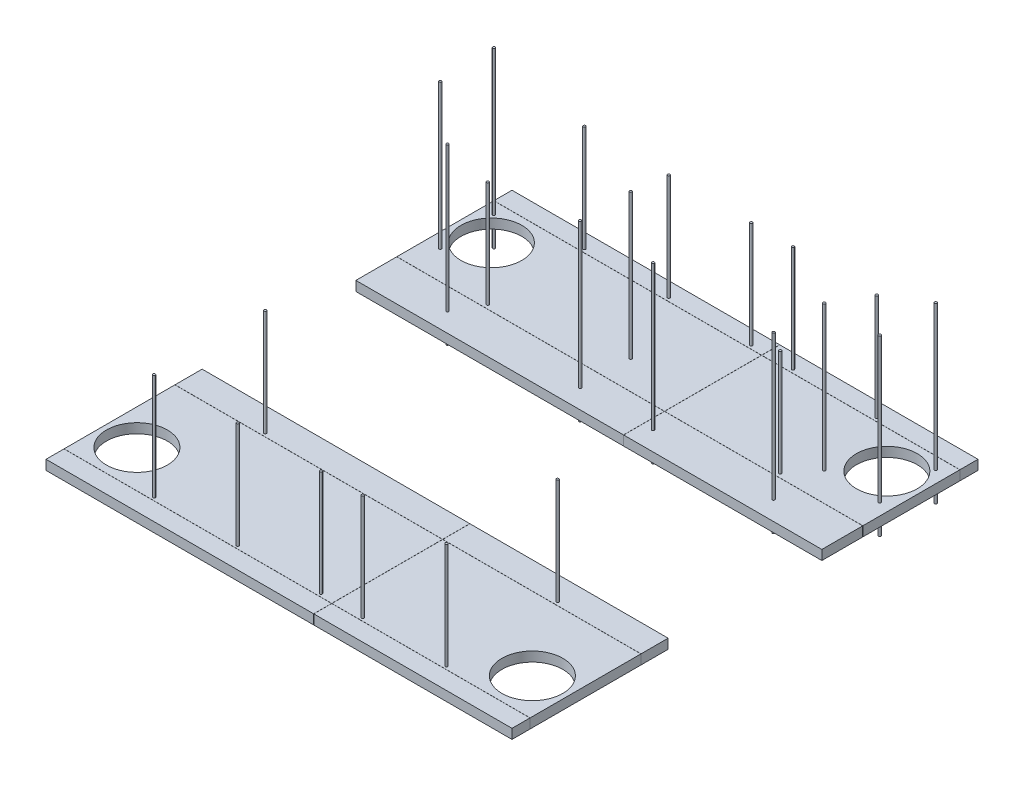
from build123d import *

# Parameters (mm, degrees)
SKETCH1_W                        = 4908.55
SKETCH1_H                        = 4908.55
BOSS_EXTRUDE1_DEPTH              = 101.6
SKETCH2_W                        = 4908.55
SKETCH2_H                        = 1619.25
CUT_EXTRUDE1_DEPTH               = 3473.355700566
SKETCH4_W                        = 4908.55
SKETCH4_H                        = 1.27
CUT_EXTRUDE_THIN1_DEPTH          = 3473.355700566
CUT_EXTRUDE_THIN2_DEPTH          = 3473.355700566
CUT_EXTRUDE_THIN2_DEPTH_BACK     = 3473.355700566
SKETCH5_W                        = 1.27
SKETCH5_H                        = 4908.55
SKETCH6_R                        = 320.675
CUT_EXTRUDE2_DEPTH               = 3473.355700566
STUD_LAYOUT_SKETCH_DEPTH         = 1524
STUD_LAYOUT_SKETCH_DEPTH_BACK    = 304.8
SKETCH7_R                        = 12.7
STUD_LAYOUT_SKETCH_2_DEPTH       = 1524
STUD_LAYOUT_SKETCH_2_DEPTH_BACK  = 304.8
STUD_LAYOUT_SKETCH_3_DEPTH       = 1524
STUD_LAYOUT_SKETCH_3_DEPTH_BACK  = 304.8
STUD_LAYOUT_SKETCH_4_DEPTH       = 1524
STUD_LAYOUT_SKETCH_4_DEPTH_BACK  = 304.8
STUD_LAYOUT_SKETCH_5_DEPTH       = 1524
STUD_LAYOUT_SKETCH_5_DEPTH_BACK  = 304.8
STUD_LAYOUT_SKETCH_6_DEPTH       = 1524
STUD_LAYOUT_SKETCH_6_DEPTH_BACK  = 304.8
STUD_LAYOUT_SKETCH_7_DEPTH       = 1524
STUD_LAYOUT_SKETCH_7_DEPTH_BACK  = 304.8
STUD_LAYOUT_SKETCH_8_DEPTH       = 1524
STUD_LAYOUT_SKETCH_8_DEPTH_BACK  = 304.8
STUD_LAYOUT_SKETCH_9_DEPTH       = 1524
STUD_LAYOUT_SKETCH_9_DEPTH_BACK  = 304.8
STUD_LAYOUT_SKETCH_10_DEPTH      = 1524
STUD_LAYOUT_SKETCH_10_DEPTH_BACK = 304.8
STUD_LAYOUT_SKETCH_11_DEPTH      = 1524
STUD_LAYOUT_SKETCH_11_DEPTH_BACK = 304.8
STUD_LAYOUT_SKETCH_12_DEPTH      = 1524
STUD_LAYOUT_SKETCH_12_DEPTH_BACK = 304.8
STUD_LAYOUT_SKETCH_13_DEPTH      = 1524
STUD_LAYOUT_SKETCH_13_DEPTH_BACK = 304.8
STUD_LAYOUT_SKETCH_14_DEPTH      = 1524
STUD_LAYOUT_SKETCH_14_DEPTH_BACK = 304.8
STUD_LAYOUT_SKETCH_15_DEPTH      = 1524
STUD_LAYOUT_SKETCH_15_DEPTH_BACK = 304.8
STUD_LAYOUT_SKETCH_16_DEPTH      = 1524
STUD_LAYOUT_SKETCH_16_DEPTH_BACK = 304.8
STUD_LAYOUT_SKETCH_17_DEPTH      = 1524
STUD_LAYOUT_SKETCH_17_DEPTH_BACK = 304.8
STUD_LAYOUT_SKETCH_18_DEPTH      = 1524
STUD_LAYOUT_SKETCH_18_DEPTH_BACK = 304.8
STUD_LAYOUT_SKETCH_19_DEPTH      = 1524
STUD_LAYOUT_SKETCH_19_DEPTH_BACK = 304.8
STUD_LAYOUT_SKETCH_20_DEPTH      = 1524
STUD_LAYOUT_SKETCH_20_DEPTH_BACK = 304.8
STUD_LAYOUT_SKETCH_21_DEPTH      = 1524
STUD_LAYOUT_SKETCH_21_DEPTH_BACK = 304.8
STUD_LAYOUT_SKETCH_22_DEPTH      = 1524
STUD_LAYOUT_SKETCH_22_DEPTH_BACK = 304.8
STUD_LAYOUT_SKETCH_23_DEPTH      = 1524
STUD_LAYOUT_SKETCH_23_DEPTH_BACK = 304.8
STUD_LAYOUT_SKETCH_24_DEPTH      = 1524
STUD_LAYOUT_SKETCH_24_DEPTH_BACK = 304.8
SKETCH8_W                        = 5497.787174958
SKETCH8_H                        = 7518.420007062
CUT_EXTRUDE5_DEPTH               = 406.4
SKETCH9_W                        = 5184.868781488
SKETCH9_H                        = 7370.4919608
CUT_EXTRUDE6_DEPTH               = 254


with BuildPart() as part:
    # Sketch1 → Boss-Extrude1 (new body)
    with BuildSketch(Plane(origin=(0, 0, 0), x_dir=(1, 0, 0), z_dir=(0, 1, 0))):
        Rectangle(SKETCH1_W, SKETCH1_H)
    extrude(amount=BOSS_EXTRUDE1_DEPTH)

    # Sketch2 → Cut-Extrude1 (cut, through all)
    with BuildSketch(Plane(origin=(0, 101.6, 0), x_dir=(1, 0, 0), z_dir=(0, 1, 0))):
        Rectangle(SKETCH2_W, SKETCH2_H)
    extrude(amount=-CUT_EXTRUDE1_DEPTH, mode=Mode.SUBTRACT)


with BuildPart() as cut_extrude1_piece_1:
    # of the separate pieces the step leaves, piece 1, a body of its own (cut_extrude1_pieces)
    add(part.part.solids().sort_by_distance((-2454.275, 0, -2454.275))[0])


with BuildPart() as cut_extrude1_piece_2:
    # of the separate pieces the step leaves, piece 2, a body of its own (cut_extrude1_pieces)
    add(part.part.solids().sort_by_distance((-2454.275, 0, 2454.275))[0])


with BuildPart() as cut_extrude_thin1_tool:
    # Sketch4 → Cut-Extrude-Thin1 (new, through all)
    with BuildSketch(Plane(origin=(0, 101.6, 0), x_dir=(1, 0, 0), z_dir=(0, 1, 0))):
        with Locations((0, -2264.41)):
            Rectangle(SKETCH4_W, SKETCH4_H)
        with Locations((0, -1096.01)):
            Rectangle(SKETCH4_W, SKETCH4_H)
        with Locations((0, 2263.14)):
            Rectangle(SKETCH4_W, SKETCH4_H)
        with Locations((0, 1240.79)):
            Rectangle(SKETCH4_W, SKETCH4_H)
    extrude(amount=-CUT_EXTRUDE_THIN1_DEPTH)


with BuildPart() as cut_extrude1_piece_1_1:
    add(cut_extrude1_piece_1.part)

    # Cut-Extrude-Thin1: cut by cut_extrude_thin1_tool
    add(cut_extrude_thin1_tool.part, mode=Mode.SUBTRACT)


with BuildPart() as cut_extrude1_piece_2_1:
    add(cut_extrude1_piece_2.part)

    # Cut-Extrude-Thin1: cut by cut_extrude_thin1_tool
    add(cut_extrude_thin1_tool.part, mode=Mode.SUBTRACT)


with BuildPart() as cut_extrude_thin1_piece_1:
    # of the separate pieces the step leaves, piece 1, a body of its own (cut_extrude_thin1_pieces)
    add(cut_extrude1_piece_1_1.part.solids().sort_by_distance((-2454.275, 0, -1241.425))[0])


with BuildPart() as cut_extrude_thin1_piece_2:
    # of the separate pieces the step leaves, piece 2, a body of its own (cut_extrude_thin1_pieces)
    add(cut_extrude1_piece_1_1.part.solids().sort_by_distance((-2454.275, 0, -809.625))[0])


with BuildPart() as cut_extrude_thin1_piece_3:
    # of the separate pieces the step leaves, piece 3, a body of its own (cut_extrude_thin1_pieces)
    add(cut_extrude1_piece_1_1.part.solids().sort_by_distance((-2454.275, 0, -2454.275))[0])


with BuildPart() as cut_extrude_thin1_piece_1_of_cut_extrude:
    # of the separate pieces the step leaves, piece 1, a body of its own (cut_extrude_thin1_pieces_of_cut_extrude1)
    add(cut_extrude1_piece_2_1.part.solids().sort_by_distance((-2454.275, 0, 2263.775))[0])


with BuildPart() as cut_extrude_thin1_piece_2_of_cut_extrude:
    # of the separate pieces the step leaves, piece 2, a body of its own (cut_extrude_thin1_pieces_of_cut_extrude1)
    add(cut_extrude1_piece_2_1.part.solids().sort_by_distance((-2454.275, 0, 1095.375))[0])


with BuildPart() as cut_extrude_thin1_piece_3_of_cut_extrude:
    # of the separate pieces the step leaves, piece 3, a body of its own (cut_extrude_thin1_pieces_of_cut_extrude1)
    add(cut_extrude1_piece_2_1.part.solids().sort_by_distance((-2454.275, 0, 2454.275))[0])


with BuildPart() as cut_extrude_thin2_tool:
    # Sketch5 → Cut-Extrude-Thin2 (new, two sides: drawn at the far end of the back side and taken through both)
    with BuildSketch(Plane(origin=(0, 101.6, 0), x_dir=(1, 0, 0), z_dir=(0, 1, 0)).offset(-CUT_EXTRUDE_THIN2_DEPTH_BACK)):
        with Locations((365.76, 0)):
            Rectangle(SKETCH5_W, SKETCH5_H)
    extrude(amount=CUT_EXTRUDE_THIN2_DEPTH + CUT_EXTRUDE_THIN2_DEPTH_BACK)


with BuildPart() as cut_extrude_thin1_piece_1_1:
    add(cut_extrude_thin1_piece_1.part)

    # Cut-Extrude-Thin2: cut by cut_extrude_thin2_tool
    add(cut_extrude_thin2_tool.part, mode=Mode.SUBTRACT)


with BuildPart() as cut_extrude_thin1_piece_2_1:
    add(cut_extrude_thin1_piece_2.part)

    # Cut-Extrude-Thin2: cut by cut_extrude_thin2_tool
    add(cut_extrude_thin2_tool.part, mode=Mode.SUBTRACT)


with BuildPart() as cut_extrude_thin1_piece_3_1:
    add(cut_extrude_thin1_piece_3.part)

    # Cut-Extrude-Thin2: cut by cut_extrude_thin2_tool
    add(cut_extrude_thin2_tool.part, mode=Mode.SUBTRACT)


with BuildPart() as cut_extrude_thin1_piece_1_of_cut_extrude_1:
    add(cut_extrude_thin1_piece_1_of_cut_extrude.part)

    # Cut-Extrude-Thin2: cut by cut_extrude_thin2_tool
    add(cut_extrude_thin2_tool.part, mode=Mode.SUBTRACT)


with BuildPart() as cut_extrude_thin1_piece_2_of_cut_extrude_1:
    add(cut_extrude_thin1_piece_2_of_cut_extrude.part)

    # Cut-Extrude-Thin2: cut by cut_extrude_thin2_tool
    add(cut_extrude_thin2_tool.part, mode=Mode.SUBTRACT)


with BuildPart() as cut_extrude_thin1_piece_3_of_cut_extrude_1:
    add(cut_extrude_thin1_piece_3_of_cut_extrude.part)

    # Cut-Extrude-Thin2: cut by cut_extrude_thin2_tool
    add(cut_extrude_thin2_tool.part, mode=Mode.SUBTRACT)


with BuildPart() as cut_extrude_thin2_piece_1:
    # of the separate pieces the step leaves, piece 1, a body of its own (cut_extrude_thin2_pieces)
    add(cut_extrude_thin1_piece_1_1.part.solids().sort_by_distance((-2454.275, 0, -1241.425))[0])


with BuildPart() as cut_extrude_thin2_piece_2:
    # of the separate pieces the step leaves, piece 2, a body of its own (cut_extrude_thin2_pieces)
    add(cut_extrude_thin1_piece_1_1.part.solids().sort_by_distance((2454.275, 0, -2262.505))[0])


with BuildPart() as cut_extrude_thin2_piece_1_of_cut_extrude:
    # of the separate pieces the step leaves, piece 1, a body of its own (cut_extrude_thin2_pieces_of_cut_extrude)
    add(cut_extrude_thin1_piece_2_1.part.solids().sort_by_distance((-2454.275, 0, -809.625))[0])


with BuildPart() as cut_extrude_thin2_piece_2_of_cut_extrude:
    # of the separate pieces the step leaves, piece 2, a body of its own (cut_extrude_thin2_pieces_of_cut_extrude)
    add(cut_extrude_thin1_piece_2_1.part.solids().sort_by_distance((2454.275, 0, -1240.155))[0])


with BuildPart() as cut_extrude_thin2_piece_1_of_cut_ext_2:
    # of the separate pieces the step leaves, piece 1, a body of its own (cut_extrude_thin2_pieces_of_cut_extr_2)
    add(cut_extrude_thin1_piece_3_1.part.solids().sort_by_distance((-2454.275, 0, -2454.275))[0])


with BuildPart() as cut_extrude_thin2_piece_2_of_cut_ext_2:
    # of the separate pieces the step leaves, piece 2, a body of its own (cut_extrude_thin2_pieces_of_cut_extr_2)
    add(cut_extrude_thin1_piece_3_1.part.solids().sort_by_distance((366.395, 0, -2454.275))[0])


with BuildPart() as cut_extrude_thin2_piece_1_of_cut_ext_3:
    # of the separate pieces the step leaves, piece 1, a body of its own (cut_extrude_thin2_pieces_of_cut_extr_3)
    add(cut_extrude_thin1_piece_1_of_cut_extrude_1.part.solids().sort_by_distance((-2454.275, 0, 2263.775))[0])


with BuildPart() as cut_extrude_thin2_piece_2_of_cut_ext_3:
    # of the separate pieces the step leaves, piece 2, a body of its own (cut_extrude_thin2_pieces_of_cut_extr_3)
    add(cut_extrude_thin1_piece_1_of_cut_extrude_1.part.solids().sort_by_distance((2454.275, 0, 1096.645))[0])


with BuildPart() as cut_extrude_thin2_piece_1_of_cut_ext_4:
    # of the separate pieces the step leaves, piece 1, a body of its own (cut_extrude_thin2_pieces_of_cut_extr_4)
    add(cut_extrude_thin1_piece_2_of_cut_extrude_1.part.solids().sort_by_distance((-2454.275, 0, 1095.375))[0])


with BuildPart() as cut_extrude_thin2_piece_2_of_cut_ext_4:
    # of the separate pieces the step leaves, piece 2, a body of its own (cut_extrude_thin2_pieces_of_cut_extr_4)
    add(cut_extrude_thin1_piece_2_of_cut_extrude_1.part.solids().sort_by_distance((2454.275, 0, 809.625))[0])


with BuildPart() as cut_extrude_thin2_piece_1_of_cut_ext_5:
    # of the separate pieces the step leaves, piece 1, a body of its own (cut_extrude_thin2_pieces_of_cut_extr_5)
    add(cut_extrude_thin1_piece_3_of_cut_extrude_1.part.solids().sort_by_distance((-2454.275, 0, 2454.275))[0])


with BuildPart() as cut_extrude_thin2_piece_2_of_cut_ext_5:
    # of the separate pieces the step leaves, piece 2, a body of its own (cut_extrude_thin2_pieces_of_cut_extr_5)
    add(cut_extrude_thin1_piece_3_of_cut_extrude_1.part.solids().sort_by_distance((2454.275, 0, 2265.045))[0])


with BuildPart() as cut_extrude2_tool:
    # Sketch6 → Cut-Extrude2 (new, through all)
    with BuildSketch(Plane(origin=(0, 101.6, 0), x_dir=(1, 0, 0), z_dir=(0, 1, 0))):
        with Locations(Location((2082.8, 1865.63, 0), (0, 0, 270))):
            Circle(SKETCH6_R)
        with Locations(Location((-2082.8, 1865.63, 0), (0, 0, 270))):
            Circle(SKETCH6_R)
        with Locations(Location((-2082.8, -1868.17, 0), (0, 0, 270))):
            Circle(SKETCH6_R)
        with Locations(Location((2082.8, -1868.17, 0), (0, 0, 270))):
            Circle(SKETCH6_R)
    extrude(amount=-CUT_EXTRUDE2_DEPTH)


with BuildPart() as cut_extrude_thin2_piece_1_1:
    add(cut_extrude_thin2_piece_1.part)

    # Cut-Extrude2: cut by cut_extrude2_tool
    add(cut_extrude2_tool.part, mode=Mode.SUBTRACT)


with BuildPart() as cut_extrude_thin2_piece_2_1:
    add(cut_extrude_thin2_piece_2.part)

    # Cut-Extrude2: cut by cut_extrude2_tool
    add(cut_extrude2_tool.part, mode=Mode.SUBTRACT)


with BuildPart() as cut_extrude_thin2_piece_1_of_cut_ext_3_1:
    add(cut_extrude_thin2_piece_1_of_cut_ext_3.part)

    # Cut-Extrude2: cut by cut_extrude2_tool
    add(cut_extrude2_tool.part, mode=Mode.SUBTRACT)


with BuildPart() as cut_extrude_thin2_piece_2_of_cut_ext_3_1:
    add(cut_extrude_thin2_piece_2_of_cut_ext_3.part)

    # Cut-Extrude2: cut by cut_extrude2_tool
    add(cut_extrude2_tool.part, mode=Mode.SUBTRACT)


with BuildPart() as body_13:
    # Sketch7 → STUD LAYOUT SKETCH (new, two sides: drawn at the far end of the back side and taken through both)
    with BuildSketch(Plane(origin=(0, 101.6, 0), x_dir=(1, 0, 0), z_dir=(0, 1, 0)).offset(-STUD_LAYOUT_SKETCH_DEPTH_BACK)):
        with Locations(Location((-1539.875, 2301.875, 0), (0, 0, 270))):
            Circle(SKETCH7_R)
    extrude(amount=STUD_LAYOUT_SKETCH_DEPTH + STUD_LAYOUT_SKETCH_DEPTH_BACK)


with BuildPart() as body_14:
    # Sketch7 → STUD LAYOUT SKETCH 2 (new, two sides: drawn at the far end of the back side and taken through both)
    with BuildSketch(Plane(origin=(0, 101.6, 0), x_dir=(1, 0, 0), z_dir=(0, 1, 0)).offset(-STUD_LAYOUT_SKETCH_2_DEPTH_BACK)):
        with Locations(Location((1743.075, 1546.225, 0), (0, 0, 270))):
            Circle(SKETCH7_R)
    extrude(amount=STUD_LAYOUT_SKETCH_2_DEPTH + STUD_LAYOUT_SKETCH_2_DEPTH_BACK)


with BuildPart() as body_15:
    # Sketch7 → STUD LAYOUT SKETCH 3 (new, two sides: drawn at the far end of the back side and taken through both)
    with BuildSketch(Plane(origin=(0, 101.6, 0), x_dir=(1, 0, 0), z_dir=(0, 1, 0)).offset(-STUD_LAYOUT_SKETCH_3_DEPTH_BACK)):
        with Locations(Location((473.075, 1012.825, 0), (0, 0, 270))):
            Circle(SKETCH7_R)
    extrude(amount=STUD_LAYOUT_SKETCH_3_DEPTH + STUD_LAYOUT_SKETCH_3_DEPTH_BACK)


with BuildPart() as body_16:
    # Sketch7 → STUD LAYOUT SKETCH 4 (new, two sides: drawn at the far end of the back side and taken through both)
    with BuildSketch(Plane(origin=(0, 101.6, 0), x_dir=(1, 0, 0), z_dir=(0, 1, 0)).offset(-STUD_LAYOUT_SKETCH_4_DEPTH_BACK)):
        with Locations(Location((-295.275, 1546.225, 0), (0, 0, 270))):
            Circle(SKETCH7_R)
    extrude(amount=STUD_LAYOUT_SKETCH_4_DEPTH + STUD_LAYOUT_SKETCH_4_DEPTH_BACK)


with BuildPart() as body_17:
    # Sketch7 → STUD LAYOUT SKETCH 5 (new, two sides: drawn at the far end of the back side and taken through both)
    with BuildSketch(Plane(origin=(0, 101.6, 0), x_dir=(1, 0, 0), z_dir=(0, 1, 0)).offset(-STUD_LAYOUT_SKETCH_5_DEPTH_BACK)):
        with Locations(Location((-295.275, 1012.825, 0), (0, 0, 270))):
            Circle(SKETCH7_R)
    extrude(amount=STUD_LAYOUT_SKETCH_5_DEPTH + STUD_LAYOUT_SKETCH_5_DEPTH_BACK)


with BuildPart() as body_18:
    # Sketch7 → STUD LAYOUT SKETCH 6 (new, two sides: drawn at the far end of the back side and taken through both)
    with BuildSketch(Plane(origin=(0, 101.6, 0), x_dir=(1, 0, 0), z_dir=(0, 1, 0)).offset(-STUD_LAYOUT_SKETCH_6_DEPTH_BACK)):
        with Locations(Location((-1692.275, 1012.825, 0), (0, 0, 270))):
            Circle(SKETCH7_R)
    extrude(amount=STUD_LAYOUT_SKETCH_6_DEPTH + STUD_LAYOUT_SKETCH_6_DEPTH_BACK)


with BuildPart() as body_19:
    # Sketch7 → STUD LAYOUT SKETCH 7 (new, two sides: drawn at the far end of the back side and taken through both)
    with BuildSketch(Plane(origin=(0, 101.6, 0), x_dir=(1, 0, 0), z_dir=(0, 1, 0)).offset(-STUD_LAYOUT_SKETCH_7_DEPTH_BACK)):
        with Locations(Location((1743.075, 1012.825, 0), (0, 0, 270))):
            Circle(SKETCH7_R)
    extrude(amount=STUD_LAYOUT_SKETCH_7_DEPTH + STUD_LAYOUT_SKETCH_7_DEPTH_BACK)


with BuildPart() as body_20:
    # Sketch7 → STUD LAYOUT SKETCH 8 (new, two sides: drawn at the far end of the back side and taken through both)
    with BuildSketch(Plane(origin=(0, 101.6, 0), x_dir=(1, 0, 0), z_dir=(0, 1, 0)).offset(-STUD_LAYOUT_SKETCH_8_DEPTH_BACK)):
        with Locations(Location((-2301.875, 1546.225, 0), (0, 0, 270))):
            Circle(SKETCH7_R)
    extrude(amount=STUD_LAYOUT_SKETCH_8_DEPTH + STUD_LAYOUT_SKETCH_8_DEPTH_BACK)


with BuildPart() as body_21:
    # Sketch7 → STUD LAYOUT SKETCH 9 (new, two sides: drawn at the far end of the back side and taken through both)
    with BuildSketch(Plane(origin=(0, 101.6, 0), x_dir=(1, 0, 0), z_dir=(0, 1, 0)).offset(-STUD_LAYOUT_SKETCH_9_DEPTH_BACK)):
        with Locations(Location((2327.275, 1546.225, 0), (0, 0, 270))):
            Circle(SKETCH7_R)
    extrude(amount=STUD_LAYOUT_SKETCH_9_DEPTH + STUD_LAYOUT_SKETCH_9_DEPTH_BACK)


with BuildPart() as body_22:
    # Sketch7 → STUD LAYOUT SKETCH 10 (new, two sides: drawn at the far end of the back side and taken through both)
    with BuildSketch(Plane(origin=(0, 101.6, 0), x_dir=(1, 0, 0), z_dir=(0, 1, 0)).offset(-STUD_LAYOUT_SKETCH_10_DEPTH_BACK)):
        with Locations(Location((-2327.275, 2136.775, 0), (0, 0, 270))):
            Circle(SKETCH7_R)
    extrude(amount=STUD_LAYOUT_SKETCH_10_DEPTH + STUD_LAYOUT_SKETCH_10_DEPTH_BACK)


with BuildPart() as body_23:
    # Sketch7 → STUD LAYOUT SKETCH 11 (new, two sides: drawn at the far end of the back side and taken through both)
    with BuildSketch(Plane(origin=(0, 101.6, 0), x_dir=(1, 0, 0), z_dir=(0, 1, 0)).offset(-STUD_LAYOUT_SKETCH_11_DEPTH_BACK)):
        with Locations(Location((2327.275, 2136.775, 0), (0, 0, 270))):
            Circle(SKETCH7_R)
    extrude(amount=STUD_LAYOUT_SKETCH_11_DEPTH + STUD_LAYOUT_SKETCH_11_DEPTH_BACK)


with BuildPart() as body_24:
    # Sketch7 → STUD LAYOUT SKETCH 12 (new, two sides: drawn at the far end of the back side and taken through both)
    with BuildSketch(Plane(origin=(0, 101.6, 0), x_dir=(1, 0, 0), z_dir=(0, 1, 0)).offset(-STUD_LAYOUT_SKETCH_12_DEPTH_BACK)):
        with Locations(Location((219.075, 2301.875, 0), (0, 0, 270))):
            Circle(SKETCH7_R)
    extrude(amount=STUD_LAYOUT_SKETCH_12_DEPTH + STUD_LAYOUT_SKETCH_12_DEPTH_BACK)


with BuildPart() as body_25:
    # Sketch7 → STUD LAYOUT SKETCH 13 (new, two sides: drawn at the far end of the back side and taken through both)
    with BuildSketch(Plane(origin=(0, 101.6, 0), x_dir=(1, 0, 0), z_dir=(0, 1, 0)).offset(-STUD_LAYOUT_SKETCH_13_DEPTH_BACK)):
        with Locations(Location((658.495, 2301.875, 0), (0, 0, 270))):
            Circle(SKETCH7_R)
    extrude(amount=STUD_LAYOUT_SKETCH_13_DEPTH + STUD_LAYOUT_SKETCH_13_DEPTH_BACK)


with BuildPart() as body_26:
    # Sketch7 → STUD LAYOUT SKETCH 14 (new, two sides: drawn at the far end of the back side and taken through both)
    with BuildSketch(Plane(origin=(0, 101.6, 0), x_dir=(1, 0, 0), z_dir=(0, 1, 0)).offset(-STUD_LAYOUT_SKETCH_14_DEPTH_BACK)):
        with Locations(Location((1539.875, 2301.875, 0), (0, 0, 270))):
            Circle(SKETCH7_R)
    extrude(amount=STUD_LAYOUT_SKETCH_14_DEPTH + STUD_LAYOUT_SKETCH_14_DEPTH_BACK)


with BuildPart() as body_27:
    # Sketch7 → STUD LAYOUT SKETCH 15 (new, two sides: drawn at the far end of the back side and taken through both)
    with BuildSketch(Plane(origin=(0, 101.6, 0), x_dir=(1, 0, 0), z_dir=(0, 1, 0)).offset(-STUD_LAYOUT_SKETCH_15_DEPTH_BACK)):
        with Locations(Location((-650.875, 2301.875, 0), (0, 0, 270))):
            Circle(SKETCH7_R)
    extrude(amount=STUD_LAYOUT_SKETCH_15_DEPTH + STUD_LAYOUT_SKETCH_15_DEPTH_BACK)


with BuildPart() as body_28:
    # Sketch7 → STUD LAYOUT SKETCH 16 (new, two sides: drawn at the far end of the back side and taken through both)
    with BuildSketch(Plane(origin=(0, 101.6, 0), x_dir=(1, 0, 0), z_dir=(0, 1, 0)).offset(-STUD_LAYOUT_SKETCH_16_DEPTH_BACK)):
        with Locations(Location((-1539.875, 1285.875, 0), (0, 0, 270))):
            Circle(SKETCH7_R)
    extrude(amount=STUD_LAYOUT_SKETCH_16_DEPTH + STUD_LAYOUT_SKETCH_16_DEPTH_BACK)


with BuildPart() as body_29:
    # Sketch7 → STUD LAYOUT SKETCH 17 (new, two sides: drawn at the far end of the back side and taken through both)
    with BuildSketch(Plane(origin=(0, 101.6, 0), x_dir=(1, 0, 0), z_dir=(0, 1, 0)).offset(-STUD_LAYOUT_SKETCH_17_DEPTH_BACK)):
        with Locations(Location((1539.875, 1285.875, 0), (0, 0, 270))):
            Circle(SKETCH7_R)
    extrude(amount=STUD_LAYOUT_SKETCH_17_DEPTH + STUD_LAYOUT_SKETCH_17_DEPTH_BACK)


with BuildPart() as body_30:
    # Sketch7 → STUD LAYOUT SKETCH 18 (new, two sides: drawn at the far end of the back side and taken through both)
    with BuildSketch(Plane(origin=(0, 101.6, 0), x_dir=(1, 0, 0), z_dir=(0, 1, 0)).offset(-STUD_LAYOUT_SKETCH_18_DEPTH_BACK)):
        with Locations(Location((-1539.875, -1058.595975439, 0), (0, 0, 270))):
            Circle(SKETCH7_R)
    extrude(amount=STUD_LAYOUT_SKETCH_18_DEPTH + STUD_LAYOUT_SKETCH_18_DEPTH_BACK)


with BuildPart() as body_31:
    # Sketch7 → STUD LAYOUT SKETCH 19 (new, two sides: drawn at the far end of the back side and taken through both)
    with BuildSketch(Plane(origin=(0, 101.6, 0), x_dir=(1, 0, 0), z_dir=(0, 1, 0)).offset(-STUD_LAYOUT_SKETCH_19_DEPTH_BACK)):
        with Locations(Location((-1539.875, -2230.249923642, 0), (0, 0, 270))):
            Circle(SKETCH7_R)
    extrude(amount=STUD_LAYOUT_SKETCH_19_DEPTH + STUD_LAYOUT_SKETCH_19_DEPTH_BACK)


with BuildPart() as body_32:
    # Sketch7 → STUD LAYOUT SKETCH 20 (new, two sides: drawn at the far end of the back side and taken through both)
    with BuildSketch(Plane(origin=(0, 101.6, 0), x_dir=(1, 0, 0), z_dir=(0, 1, 0)).offset(-STUD_LAYOUT_SKETCH_20_DEPTH_BACK)):
        with Locations(Location((-658.765974284, -2230.249923642, 0), (0, 0, 270))):
            Circle(SKETCH7_R)
    extrude(amount=STUD_LAYOUT_SKETCH_20_DEPTH + STUD_LAYOUT_SKETCH_20_DEPTH_BACK)


with BuildPart() as body_33:
    # Sketch7 → STUD LAYOUT SKETCH 21 (new, two sides: drawn at the far end of the back side and taken through both)
    with BuildSketch(Plane(origin=(0, 101.6, 0), x_dir=(1, 0, 0), z_dir=(0, 1, 0)).offset(-STUD_LAYOUT_SKETCH_21_DEPTH_BACK)):
        with Locations(Location((219.075, -2230.249923642, 0), (0, 0, 270))):
            Circle(SKETCH7_R)
    extrude(amount=STUD_LAYOUT_SKETCH_21_DEPTH + STUD_LAYOUT_SKETCH_21_DEPTH_BACK)


with BuildPart() as body_34:
    # Sketch7 → STUD LAYOUT SKETCH 22 (new, two sides: drawn at the far end of the back side and taken through both)
    with BuildSketch(Plane(origin=(0, 101.6, 0), x_dir=(1, 0, 0), z_dir=(0, 1, 0)).offset(-STUD_LAYOUT_SKETCH_22_DEPTH_BACK)):
        with Locations(Location((658.495, -2230.249923642, 0), (0, 0, 270))):
            Circle(SKETCH7_R)
    extrude(amount=STUD_LAYOUT_SKETCH_22_DEPTH + STUD_LAYOUT_SKETCH_22_DEPTH_BACK)


with BuildPart() as body_35:
    # Sketch7 → STUD LAYOUT SKETCH 23 (new, two sides: drawn at the far end of the back side and taken through both)
    with BuildSketch(Plane(origin=(0, 101.6, 0), x_dir=(1, 0, 0), z_dir=(0, 1, 0)).offset(-STUD_LAYOUT_SKETCH_23_DEPTH_BACK)):
        with Locations(Location((1539.875, -2230.249923642, 0), (0, 0, 270))):
            Circle(SKETCH7_R)
    extrude(amount=STUD_LAYOUT_SKETCH_23_DEPTH + STUD_LAYOUT_SKETCH_23_DEPTH_BACK)


with BuildPart() as body_36:
    # Sketch7 → STUD LAYOUT SKETCH 24 (new, two sides: drawn at the far end of the back side and taken through both)
    with BuildSketch(Plane(origin=(0, 101.6, 0), x_dir=(1, 0, 0), z_dir=(0, 1, 0)).offset(-STUD_LAYOUT_SKETCH_24_DEPTH_BACK)):
        with Locations(Location((1539.875, -1058.595975439, 0), (0, 0, 270))):
            Circle(SKETCH7_R)
    extrude(amount=STUD_LAYOUT_SKETCH_24_DEPTH + STUD_LAYOUT_SKETCH_24_DEPTH_BACK)


with BuildPart() as cut_extrude5_tool:
    # Sketch8 → Cut-Extrude5 (new body)
    with BuildSketch(Plane(origin=(0, 1625.6, 0), x_dir=(1, 0, 0), z_dir=(0, 1, 0))):
        Rectangle(SKETCH8_W, SKETCH8_H)
    extrude(amount=-CUT_EXTRUDE5_DEPTH)


with BuildPart() as body_13_1:
    add(body_13.part)

    # Cut-Extrude5: cut by cut_extrude5_tool
    add(cut_extrude5_tool.part, mode=Mode.SUBTRACT)


with BuildPart() as body_24_1:
    add(body_24.part)

    # Cut-Extrude5: cut by cut_extrude5_tool
    add(cut_extrude5_tool.part, mode=Mode.SUBTRACT)


with BuildPart() as body_25_1:
    add(body_25.part)

    # Cut-Extrude5: cut by cut_extrude5_tool
    add(cut_extrude5_tool.part, mode=Mode.SUBTRACT)


with BuildPart() as body_26_1:
    add(body_26.part)

    # Cut-Extrude5: cut by cut_extrude5_tool
    add(cut_extrude5_tool.part, mode=Mode.SUBTRACT)


with BuildPart() as body_27_1:
    add(body_27.part)

    # Cut-Extrude5: cut by cut_extrude5_tool
    add(cut_extrude5_tool.part, mode=Mode.SUBTRACT)


with BuildPart() as body_28_1:
    add(body_28.part)

    # Cut-Extrude5: cut by cut_extrude5_tool
    add(cut_extrude5_tool.part, mode=Mode.SUBTRACT)


with BuildPart() as body_29_1:
    add(body_29.part)

    # Cut-Extrude5: cut by cut_extrude5_tool
    add(cut_extrude5_tool.part, mode=Mode.SUBTRACT)


with BuildPart() as body_30_1:
    add(body_30.part)

    # Cut-Extrude5: cut by cut_extrude5_tool
    add(cut_extrude5_tool.part, mode=Mode.SUBTRACT)


with BuildPart() as body_31_1:
    add(body_31.part)

    # Cut-Extrude5: cut by cut_extrude5_tool
    add(cut_extrude5_tool.part, mode=Mode.SUBTRACT)


with BuildPart() as body_32_1:
    add(body_32.part)

    # Cut-Extrude5: cut by cut_extrude5_tool
    add(cut_extrude5_tool.part, mode=Mode.SUBTRACT)


with BuildPart() as body_33_1:
    add(body_33.part)

    # Cut-Extrude5: cut by cut_extrude5_tool
    add(cut_extrude5_tool.part, mode=Mode.SUBTRACT)


with BuildPart() as body_34_1:
    add(body_34.part)

    # Cut-Extrude5: cut by cut_extrude5_tool
    add(cut_extrude5_tool.part, mode=Mode.SUBTRACT)


with BuildPart() as body_35_1:
    add(body_35.part)

    # Cut-Extrude5: cut by cut_extrude5_tool
    add(cut_extrude5_tool.part, mode=Mode.SUBTRACT)


with BuildPart() as body_36_1:
    add(body_36.part)

    # Cut-Extrude5: cut by cut_extrude5_tool
    add(cut_extrude5_tool.part, mode=Mode.SUBTRACT)


with BuildPart() as cut_extrude6_tool:
    # Sketch9 → Cut-Extrude6 (new body)
    with BuildSketch(Plane.XZ.offset(203.2)):
        Rectangle(SKETCH9_W, SKETCH9_H)
    extrude(amount=-CUT_EXTRUDE6_DEPTH)


with BuildPart() as body_13_2:
    add(body_13_1.part)

    # Cut-Extrude6: cut by cut_extrude6_tool
    add(cut_extrude6_tool.part, mode=Mode.SUBTRACT)


with BuildPart() as body_24_2:
    add(body_24_1.part)

    # Cut-Extrude6: cut by cut_extrude6_tool
    add(cut_extrude6_tool.part, mode=Mode.SUBTRACT)


with BuildPart() as body_25_2:
    add(body_25_1.part)

    # Cut-Extrude6: cut by cut_extrude6_tool
    add(cut_extrude6_tool.part, mode=Mode.SUBTRACT)


with BuildPart() as body_26_2:
    add(body_26_1.part)

    # Cut-Extrude6: cut by cut_extrude6_tool
    add(cut_extrude6_tool.part, mode=Mode.SUBTRACT)


with BuildPart() as body_27_2:
    add(body_27_1.part)

    # Cut-Extrude6: cut by cut_extrude6_tool
    add(cut_extrude6_tool.part, mode=Mode.SUBTRACT)


with BuildPart() as body_28_2:
    add(body_28_1.part)

    # Cut-Extrude6: cut by cut_extrude6_tool
    add(cut_extrude6_tool.part, mode=Mode.SUBTRACT)


with BuildPart() as body_29_2:
    add(body_29_1.part)

    # Cut-Extrude6: cut by cut_extrude6_tool
    add(cut_extrude6_tool.part, mode=Mode.SUBTRACT)


with BuildPart() as body_30_2:
    add(body_30_1.part)

    # Cut-Extrude6: cut by cut_extrude6_tool
    add(cut_extrude6_tool.part, mode=Mode.SUBTRACT)


with BuildPart() as body_31_2:
    add(body_31_1.part)

    # Cut-Extrude6: cut by cut_extrude6_tool
    add(cut_extrude6_tool.part, mode=Mode.SUBTRACT)


with BuildPart() as body_32_2:
    add(body_32_1.part)

    # Cut-Extrude6: cut by cut_extrude6_tool
    add(cut_extrude6_tool.part, mode=Mode.SUBTRACT)


with BuildPart() as body_33_2:
    add(body_33_1.part)

    # Cut-Extrude6: cut by cut_extrude6_tool
    add(cut_extrude6_tool.part, mode=Mode.SUBTRACT)


with BuildPart() as body_34_2:
    add(body_34_1.part)

    # Cut-Extrude6: cut by cut_extrude6_tool
    add(cut_extrude6_tool.part, mode=Mode.SUBTRACT)


with BuildPart() as body_35_2:
    add(body_35_1.part)

    # Cut-Extrude6: cut by cut_extrude6_tool
    add(cut_extrude6_tool.part, mode=Mode.SUBTRACT)


with BuildPart() as body_36_2:
    add(body_36_1.part)

    # Cut-Extrude6: cut by cut_extrude6_tool
    add(cut_extrude6_tool.part, mode=Mode.SUBTRACT)


solid = Compound([cut_extrude_thin2_piece_1_of_cut_extrude.part, cut_extrude_thin2_piece_2_of_cut_extrude.part, cut_extrude_thin2_piece_1_of_cut_ext_2.part, cut_extrude_thin2_piece_2_of_cut_ext_2.part, cut_extrude_thin2_piece_1_of_cut_ext_4.part, cut_extrude_thin2_piece_2_of_cut_ext_4.part, cut_extrude_thin2_piece_1_of_cut_ext_5.part, cut_extrude_thin2_piece_2_of_cut_ext_5.part, cut_extrude_thin2_piece_1_1.part, cut_extrude_thin2_piece_2_1.part, cut_extrude_thin2_piece_1_of_cut_ext_3_1.part, cut_extrude_thin2_piece_2_of_cut_ext_3_1.part, body_14.part, body_15.part, body_16.part, body_17.part, body_18.part, body_19.part, body_20.part, body_21.part, body_22.part, body_23.part, body_13_2.part, body_24_2.part, body_25_2.part, body_26_2.part, body_27_2.part, body_28_2.part, body_29_2.part, body_30_2.part, body_31_2.part, body_32_2.part, body_33_2.part, body_34_2.part, body_35_2.part, body_36_2.part])
